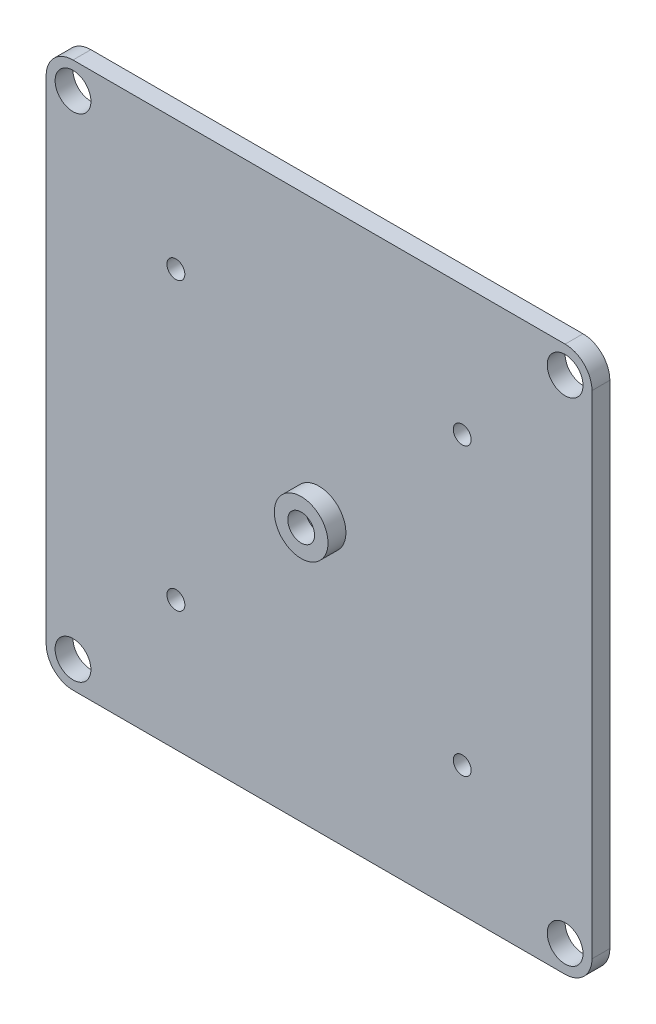
from build123d import *

# Parameters (mm, degrees)
ESQUISSE1_W              = 305
ESQUISSE1_H              = 305
BOSS_EXTRU_1_DEPTH       = 10
ESQUISSE2_R              = 10
ENL_V_MAT_EXTRU_10_DEPTH = 10
CONG_2_R                 = 15
ESQUISSE3_R              = 5
ENL_V_MAT_EXTRU_11_DEPTH = 10
ESQUISSE4_R              = 15
BOSS_EXTRU_2_DEPTH       = 10
ESQUISSE5_R              = 7.5
ENL_V_MAT_EXTRU_12_DEPTH = 10


with BuildPart() as part:
    # Esquisse1 → Boss.-Extru.1 (new body)
    with BuildSketch(Plane.XY):
        Rectangle(ESQUISSE1_W, ESQUISSE1_H)
    extrude(amount=BOSS_EXTRU_1_DEPTH)

    # Esquisse2 → Enlèv. mat.-Extru.10 (cut)
    with BuildSketch(Plane.XY.offset(10)):
        with Locations((137.5, 137.5)):
            Circle(ESQUISSE2_R)
        with Locations((137.5, -137.5)):
            Circle(ESQUISSE2_R)
        with Locations((-137.5, -137.5)):
            Circle(ESQUISSE2_R)
        with Locations((-137.5, 137.5)):
            Circle(ESQUISSE2_R)
    extrude(amount=-ENL_V_MAT_EXTRU_10_DEPTH, mode=Mode.SUBTRACT)

    # Congé2
    cong_2_edges = [part.edges().sort_by_distance(p)[0] for p in [
        (-152.5, 152.5, 5),
        (152.5, 152.5, 5),
        (152.5, -152.5, 5),
        (-152.5, -152.5, 5),
    ]]
    fillet(cong_2_edges, radius=CONG_2_R)

    # Esquisse3 → Enlèv. mat.-Extru.11 (cut)
    with BuildSketch(Plane.XY.offset(10)):
        with Locations((80, 80)):
            Circle(ESQUISSE3_R)
        with Locations((80, -80)):
            Circle(ESQUISSE3_R)
        with Locations((-80, -80)):
            Circle(ESQUISSE3_R)
        with Locations((-80, 80)):
            Circle(ESQUISSE3_R)
    extrude(amount=-ENL_V_MAT_EXTRU_11_DEPTH, mode=Mode.SUBTRACT)

    # Esquisse4 → Boss.-Extru.2 (add)
    with BuildSketch(Plane.XY.offset(10)):
        with Locations(Location((0, 0, 0), (0, 0, 180))):
            Circle(ESQUISSE4_R)
    extrude(amount=BOSS_EXTRU_2_DEPTH)

    # Esquisse5 → Enlèv. mat.-Extru.12 (cut)
    with BuildSketch(Plane.XY.offset(20)):
        Circle(ESQUISSE5_R)
    extrude(amount=-ENL_V_MAT_EXTRU_12_DEPTH, mode=Mode.SUBTRACT)


solid = part.part
